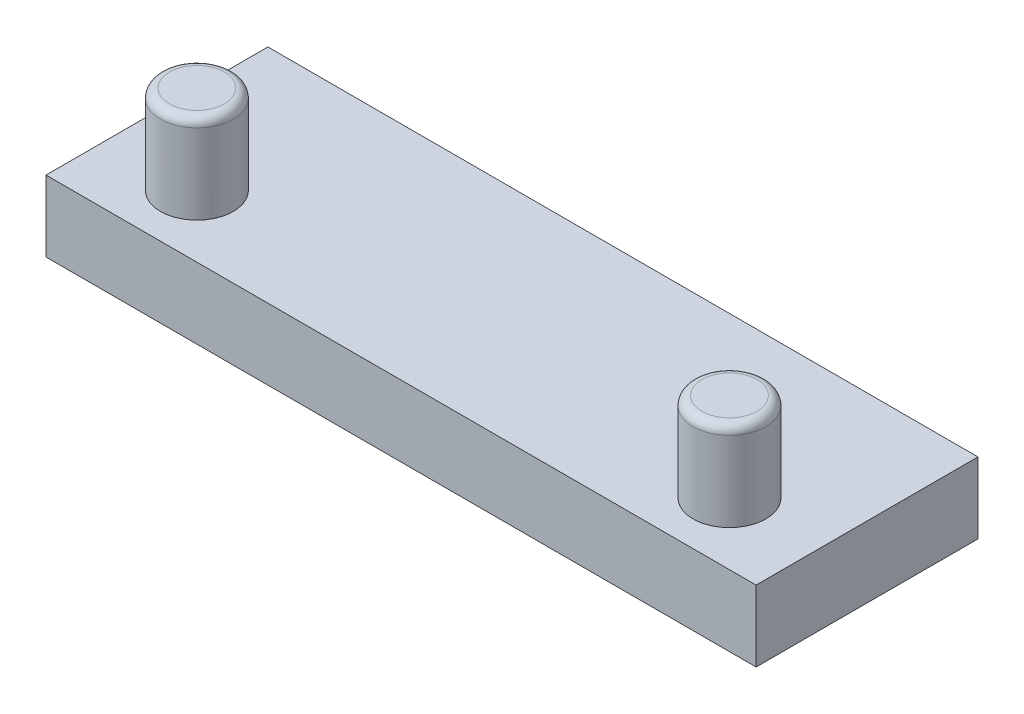
from build123d import *

# Parameters (mm, degrees)
SKETCH_1_W      = 20
SKETCH_1_H      = 10
SKETCH_1_R      = 1.5
EXTRUDE_1_DEPTH = 5
SKETCH_2_W      = 40
SKETCH_2_H      = 12.5
EXTRUDE_2_DEPTH = 4
SKETCH_3_R      = 2.05
EXTRUDE_3_DEPTH = 5
FILLET_1_R      = 0.5


with BuildPart() as part:
    # 草图1 → 凸台-拉伸1 (new body)
    with BuildSketch(Plane.XY):
        with Locations((0, 5)):
            Rectangle(SKETCH_1_W, SKETCH_1_H)
        with Locations((-5, 3)):
            Circle(SKETCH_1_R, mode=Mode.SUBTRACT)
        with Locations((5, 3)):
            Circle(SKETCH_1_R, mode=Mode.SUBTRACT)
    extrude(amount=EXTRUDE_1_DEPTH)

    # 草图2 → 凸台-拉伸2 (add)
    with BuildSketch(Plane(origin=(0, 10, 0), x_dir=(1, 0, 0), z_dir=(0, 1, 0))):
        with Locations((0, -6.25)):
            Rectangle(SKETCH_2_W, SKETCH_2_H)
    extrude(amount=-EXTRUDE_2_DEPTH)

    # 草图3 → 凸台-拉伸3 (add)
    with BuildSketch(Plane(origin=(0, 10, 0), x_dir=(1, 0, 0), z_dir=(0, 1, 0))):
        with Locations((-15, -9)):
            Circle(SKETCH_3_R)
        with Locations((15, -9)):
            Circle(SKETCH_3_R)
    extrude(amount=EXTRUDE_3_DEPTH)

    # 圆角1
    fillet_1_edges = [part.edges().sort_by_distance(p)[0] for p in [
        (-17.05, 15, 9),
        (12.95, 15, 9),
    ]]
    fillet(fillet_1_edges, radius=FILLET_1_R)


solid = part.part
